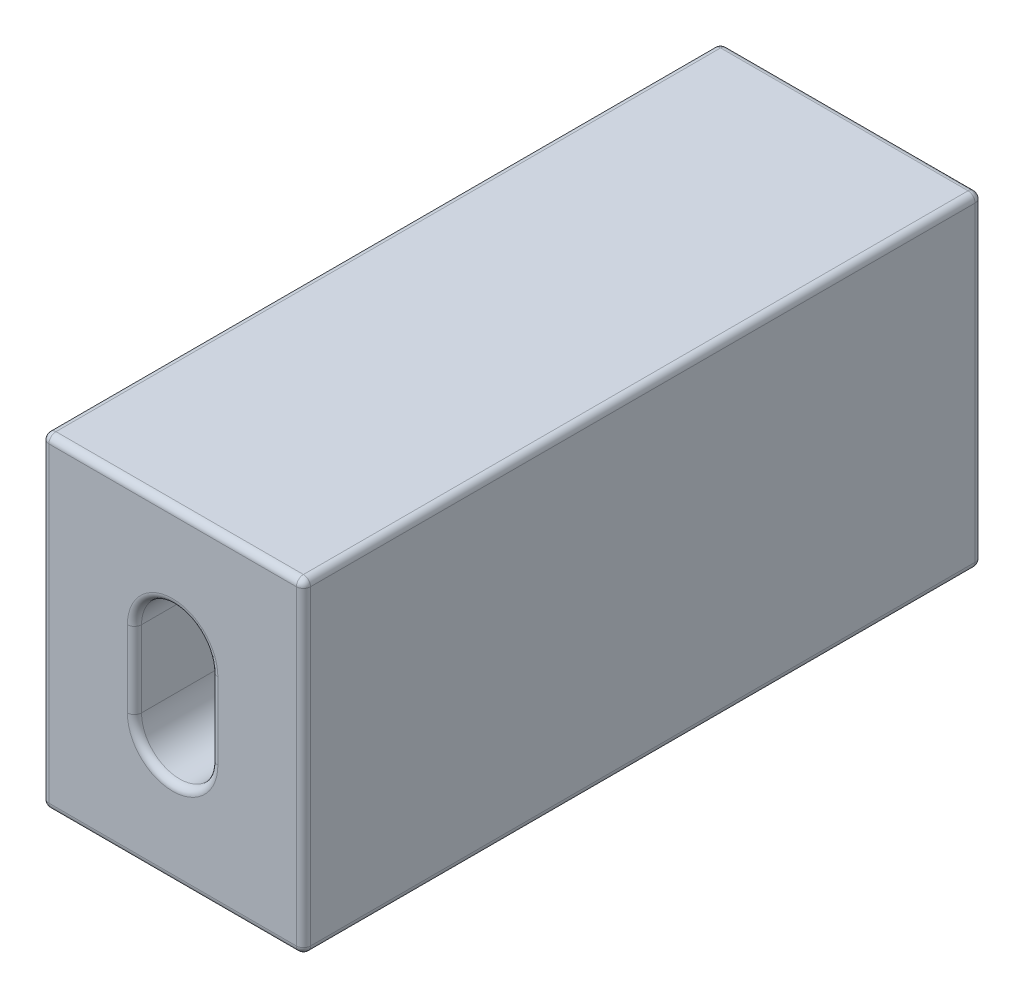
from build123d import *

# Parameters (mm, degrees)
EXTRUDE_1_DEPTH = 48
FILLET_1_R      = 0.5
FILLET_2_R      = 0.5


with BuildPart() as part:
    # Эскиз1 → Бобышка-Вытянуть1 (new body)
    with BuildSketch(Plane.XY):
        with BuildLine():
            Line((0.7, 3.35), (18.2, 3.35))
            ThreePointArc((18.2, 3.35), (18.553553391, 3.496446609), (18.7, 3.85))
            Line((18.7, 3.85), (18.7, 25.85))
            ThreePointArc((18.7, 25.85), (18.553553391, 26.203553391), (18.2, 26.35))
            Line((18.2, 26.35), (0.7, 26.35))
            ThreePointArc((0.7, 26.35), (0.346446609, 26.203553391), (0.2, 25.85))
            Line((0.2, 25.85), (0.2, 3.85))
            ThreePointArc((0.2, 3.85), (0.346446609, 3.496446609), (0.7, 3.35))
        make_face()
        with BuildLine():
            Line((6.75, 17.55), (6.75, 12.15))
            ThreePointArc((6.75, 12.15), (9.45, 9.45), (12.15, 12.15))
            Line((12.15, 12.15), (12.15, 17.55))
            ThreePointArc((12.15, 17.55), (9.45, 20.25), (6.75, 17.55))
        make_face(mode=Mode.SUBTRACT)
    extrude(amount=EXTRUDE_1_DEPTH)

    # Скругление1
    fillet_1_edges = [part.edges().sort_by_distance(p)[0] for p in [
        (9.45, 3.35, 0),
        (0.346446609, 3.496446609, 0),
        (0.2, 14.85, 0),
        (0.346446609, 26.203553391, 0),
        (9.45, 20.25, 0),
        (6.75, 14.85, 0),
        (9.45, 9.45, 0),
        (12.15, 14.85, 0),
        (9.45, 26.35, 0),
        (18.553553391, 26.203553391, 0),
        (18.7, 14.85, 0),
        (18.553553391, 3.496446609, 0),
    ]]
    fillet(fillet_1_edges, radius=FILLET_1_R)

    # Скругление2
    fillet_2_edges = [part.edges().sort_by_distance(p)[0] for p in [
        (0.346446609, 3.496446609, 48),
        (9.45, 3.35, 48),
        (18.553553391, 3.496446609, 48),
        (18.7, 14.85, 48),
        (9.45, 20.25, 48),
        (6.75, 14.85, 48),
        (9.45, 9.45, 48),
        (12.15, 14.85, 48),
        (18.553553391, 26.203553391, 48),
        (9.45, 26.35, 48),
        (0.346446609, 26.203553391, 48),
        (0.2, 14.85, 48),
    ]]
    fillet(fillet_2_edges, radius=FILLET_2_R)


solid = part.part
